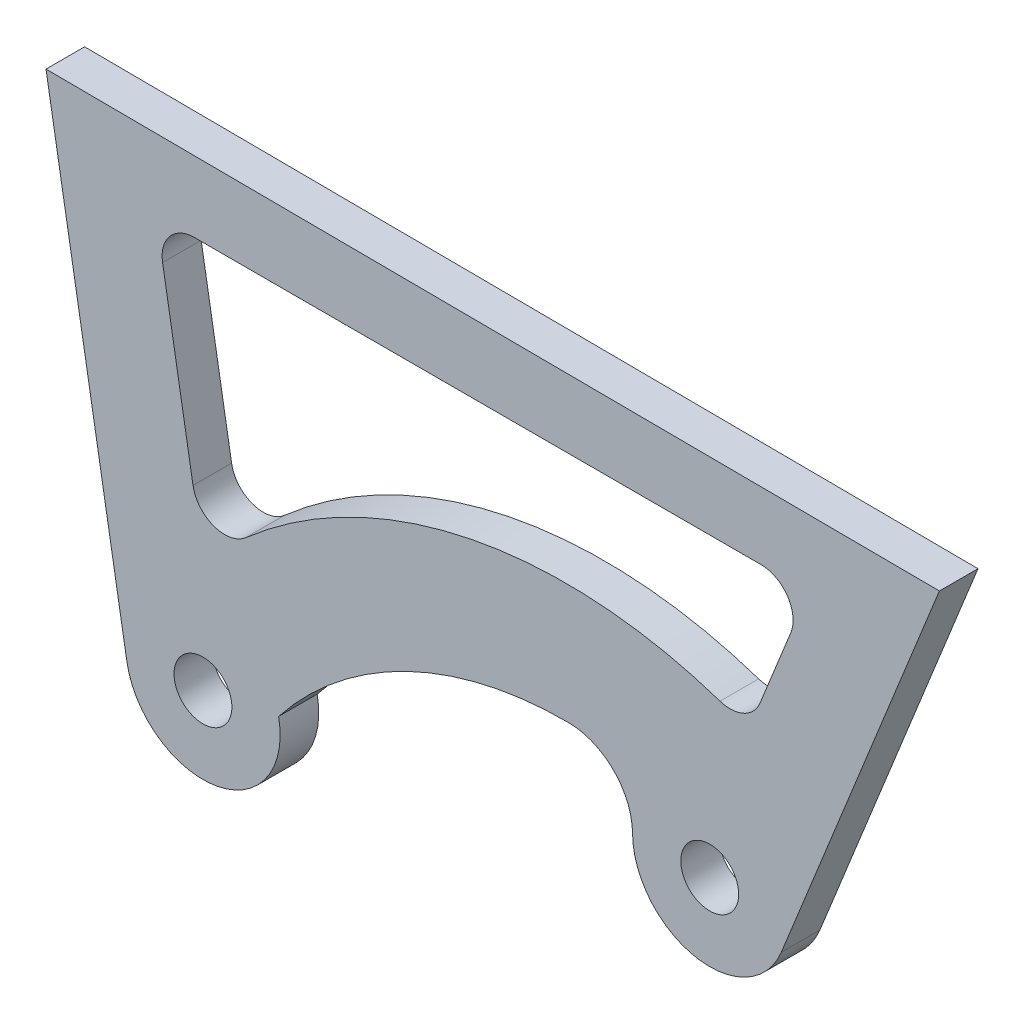
from build123d import *

# Parameters (mm, degrees)
SKETCH1_R           = 4.5
BOSS_EXTRUDE1_DEPTH = 6


with BuildPart() as part:
    # Sketch1 → Boss-Extrude1 (new body)
    with BuildSketch(Plane.XY):
        with BuildLine():
            Line((538.087061333, -362.632518419), (399.195756936, -361.813220805))
            Line((399.195756936, -361.813220805), (411.770395569, -435.296905236))
            ThreePointArc((411.770395569, -435.296905236), (425.804925586, -445.068271221), (435.358389017, -430.884514226))
            ThreePointArc((435.358389017, -430.884514226), (455.39069986, -414.804899258), (480.456241604, -409.186526513))
            ThreePointArc((480.456241604, -409.186526513), (487.46072005, -412.122937916), (490.381767865, -419.133837281))
            ThreePointArc((490.381767865, -419.133837281), (500.126063062, -430.857058146), (513.510317286, -423.560008386))
            Line((513.510317286, -423.560008386), (538.087061333, -362.632518419))
        make_face()
        with Locations((423.598466956, -433.272867865)):
            Circle(SKETCH1_R, mode=Mode.SUBTRACT)
        with Locations((502.381603037, -419.070941762)):
            Circle(SKETCH1_R, mode=Mode.SUBTRACT)
        with BuildLine():
            ThreePointArc((510.342575031, -372.949836208), (514.486982235, -375.152714664), (514.979539302, -379.820280635))
            Line((514.979539302, -379.820280635), (510.209986836, -391.644339161))
            ThreePointArc((510.209986836, -391.644339161), (507.666881017, -394.314352508), (503.985021193, -394.515018193))
            ThreePointArc((503.985021193, -394.515018193), (465.150215538, -392.093753549), (430.277606866, -409.353701903))
            ThreePointArc((430.277606866, -409.353701903), (425.309411141, -410.309514397), (422.050350523, -406.439750816))
            Line((422.050350523, -406.439750816), (417.319428607, -378.793185112))
            ThreePointArc((417.319428607, -378.793185112), (418.425701646, -374.726231434), (422.247791685, -372.949836208))
            Line((422.247791685, -372.949836208), (510.342575031, -372.949836208))
        make_face(mode=Mode.SUBTRACT)
    extrude(amount=-BOSS_EXTRUDE1_DEPTH)


solid = part.part
